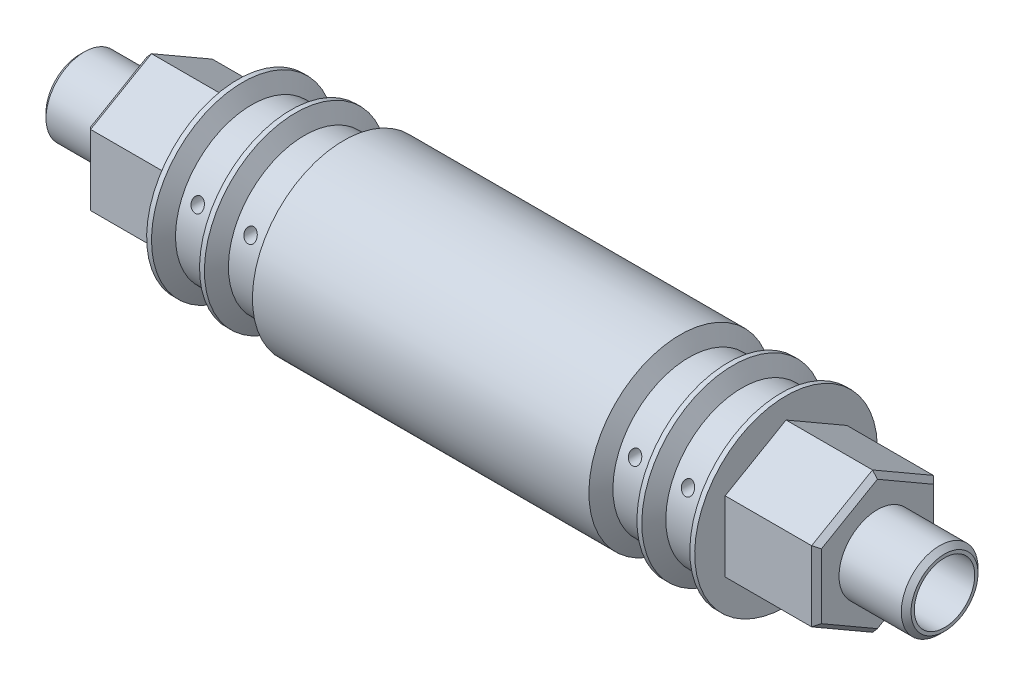
from build123d import *

# Parameters (mm, degrees)
BOSS_EXTRUDE4_DEPTH     = 9.525
CUT_EXTRUDE1_DEPTH      = 48.068686512
CUT_EXTRUDE1_DEPTH_BACK = 48.068686512
SKETCH6_R               = 0.635
CHAMFER2_SIZE           = 0.508
CHAMFER3_SIZE           = 0.508
SKETCH7_R               = 3.149999923
CUT_EXTRUDE2_DEPTH      = 92.200280975


with BuildPart() as part:
    # Sketch1 → Revolve1 (revolve)
    with BuildSketch(Plane.XY, mode=Mode.PRIVATE) as revolve1_sk:
        Polygon((-27.150456448, 7.9375), (-28.067, 9.525), (-28.575, 9.525), (-28.575, 4.254000001), (-38.1, 4.254000001), (-38.1, 4.000000001), (-45.1, 4.000000001), (-45.1, 1.599999975), (-35.275, 1.599999975), (-33.675000025, 0), (-28.575, 0), (0, 0), (0, 9.525), (-17.542825791, 9.525), (-18.459369343, 7.9375), (-21.634369343, 7.9375), (-22.550912895, 9.525), (-23.058912895, 9.525), (-23.975456448, 7.9375), align=None)
    revolve(revolve1_sk.sketch.rotate(Axis((-38.1, 0, 0), (1, 0, 0)), 180), axis=Axis((-38.1, 0, 0), (1, 0, 0)))

    # Sketch4 → Boss-Extrude4 (add)
    with BuildSketch(Plane.ZY.offset(28.575)):
        Polygon((0, 7.332348419), (-6.35, 3.666174209), (-6.35, -3.666174209), (0, -7.332348419), (6.35, -3.666174209), (6.35, 3.666174209), align=None)
    extrude(amount=BOSS_EXTRUDE4_DEPTH)

    # Sketch6 → Cut-Extrude1 (cut, two sides: drawn at the far end of the back side and taken through both)
    with BuildSketch(Plane.XY.offset(-CUT_EXTRUDE1_DEPTH_BACK)):
        with Locations((-25.562956448, 3.302)):
            Circle(SKETCH6_R)
        with Locations((-20.046869343, 3.302)):
            Circle(SKETCH6_R)
    extrude(amount=CUT_EXTRUDE1_DEPTH + CUT_EXTRUDE1_DEPTH_BACK, mode=Mode.SUBTRACT)

    # Chamfer2
    chamfer2_edges = [part.edges().sort_by_distance(p)[0] for p in [
        (-38.1, 0, 6.35),
        (-38.1, -5.499261314, 3.175),
        (-38.1, -5.499261314, -3.175),
        (-38.1, 0, -6.35),
        (-38.1, 5.499261314, -3.175),
        (-38.1, 5.499261314, 3.175),
    ]]
    chamfer(chamfer2_edges, length=CHAMFER2_SIZE)

    # Chamfer3
    chamfer3_edges = [part.edges().sort_by_distance(p)[0] for p in [
        (-45.1, 4.000000001, 0),
    ]]
    chamfer(chamfer3_edges, length=CHAMFER3_SIZE)

    # Mirror2: part across plane


with BuildPart() as part_1:
    add(part.part)
    add(part.part.mirror(Plane(origin=(0, 0, 0), x_dir=(0, 0, 1), z_dir=(1, 0, 0))))

    # Sketch7 → Cut-Extrude2 (cut, through all)
    with BuildSketch(Plane.ZY.offset(45.1)):
        with Locations(Location((0, 0, 0), (0, 0, 270))):
            Circle(SKETCH7_R)
    extrude(amount=-CUT_EXTRUDE2_DEPTH, mode=Mode.SUBTRACT)


solid = part_1.part
